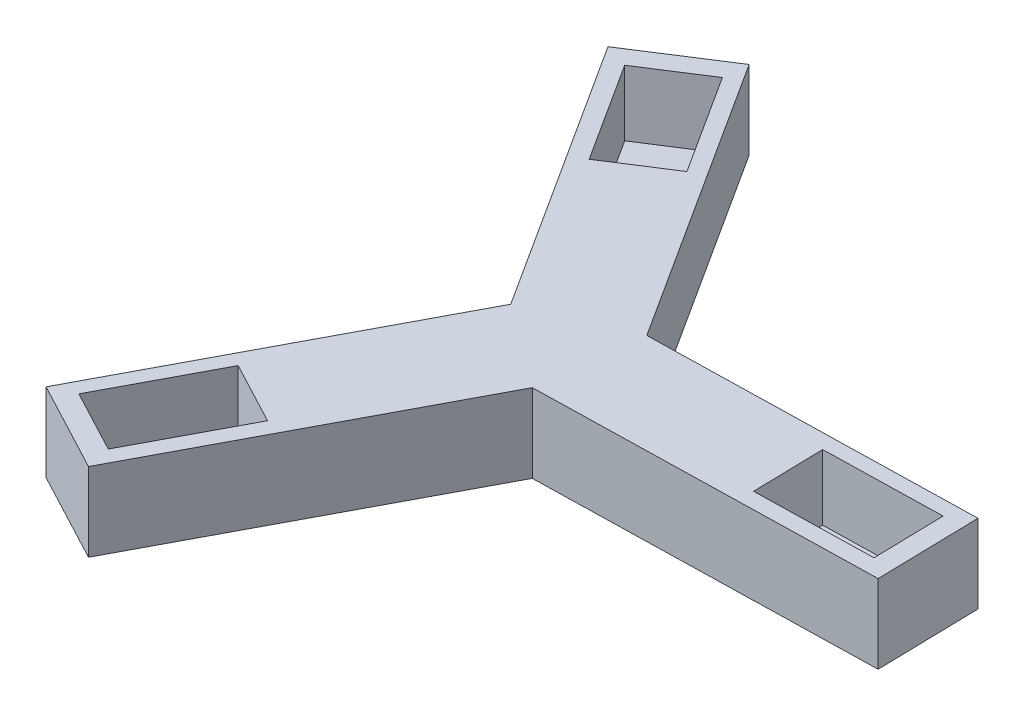
from build123d import *

# Parameters (mm, degrees)
SKETCH2_W           = 300
SKETCH2_H           = 300
BOSS_EXTRUDE1_DEPTH = 10
BOSS_EXTRUDE3_DEPTH = 30
SKETCH2_2_W         = 300
SKETCH2_2_H         = 300
CUT_EXTRUDE1_DEPTH  = 10
BOSS_EXTRUDE4_DEPTH = 5


with BuildPart() as part:
    # Sketch2 → Boss-Extrude1 (new body)
    with BuildSketch(Plane(origin=(0, 0, 0), x_dir=(1, 0, 0), z_dir=(0, 1, 0))):
        with Locations((20.355411955, -44.224555735)):
            Rectangle(SKETCH2_W, SKETCH2_H)
    extrude(amount=BOSS_EXTRUDE1_DEPTH)

    # Sketch7 → Boss-Extrude3 (add)
    with BuildSketch(Plane(origin=(0, 10, 0), x_dir=(1, 0, 0), z_dir=(0, 1, 0))):
        Polygon((-80.941936453, -162.540499595), (-46.470752527, -180.781592729), (12.159859746, -69.984141911), (141.307092119, -67.078746484), (140.429718136, -28.078746484), (16.762252316, -30.86086487), (-53.304823682, 78.277282816), (-86.123521283, 57.207563128), (-19.539590898, -46.505153929), align=None)
        Polygon((-51.304328835, -118.826374708), (-27.43966304, -131.454823801), (-48.487078194, -171.229266792), (-72.351743989, -158.6008177), align=None, mode=Mode.SUBTRACT)
        Polygon((-52.501030421, 16.405104768), (-76.812245446, 54.27283277), (-54.091608645, 68.859561784), (-29.78039362, 30.991833782), align=None, mode=Mode.SUBTRACT)
        Polygon((88.0573666, -35.018280322), (133.045983567, -34.006181808), (133.653242675, -60.999351988), (88.664625709, -62.011450502), align=None, mode=Mode.SUBTRACT)
    extrude(amount=BOSS_EXTRUDE3_DEPTH)

    # Sketch2<2> → Cut-Extrude1 (cut)
    with BuildSketch(Plane(origin=(0, 0, 0), x_dir=(1, 0, 0), z_dir=(0, 1, 0))):
        with Locations((20.355411955, -44.224555735)):
            Rectangle(SKETCH2_2_W, SKETCH2_2_H)
    extrude(amount=CUT_EXTRUDE1_DEPTH, mode=Mode.SUBTRACT)

    # Sketch7<3> → Boss-Extrude4 (add)
    with BuildSketch(Plane(origin=(0, 10, 0), x_dir=(1, 0, 0), z_dir=(0, 1, 0))):
        Polygon((-76.812245446, 54.27283277), (-52.501030421, 16.405104768), (-29.78039362, 30.991833782), (-54.091608645, 68.859561784), align=None)
        Polygon((-48.487078194, -171.229266792), (-27.43966304, -131.454823801), (-51.304328835, -118.826374708), (-72.351743989, -158.6008177), align=None)
        Polygon((133.045983567, -34.006181808), (88.0573666, -35.018280322), (88.664625709, -62.011450502), (133.653242675, -60.999351988), align=None)
    extrude(amount=BOSS_EXTRUDE4_DEPTH)


solid = part.part
